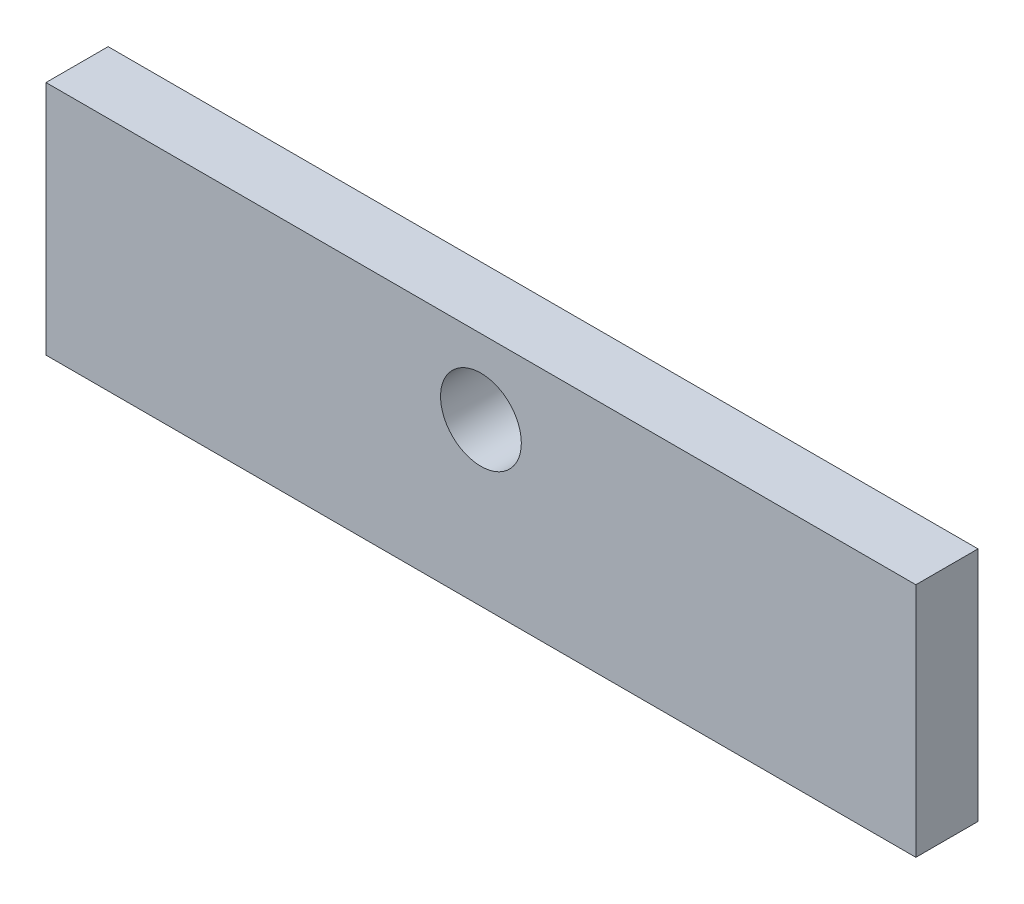
from build123d import *

# Parameters (mm, degrees)
SKETCH1_W           = 700
SKETCH1_H           = 190
BOSS_EXTRUDE1_DEPTH = 50
CUT_EXTRUDE1_REACH  = 394.301
SKETCH2_R           = 32.5


with BuildPart() as part:
    # Sketch1 → Boss-Extrude1 (new body)
    with BuildSketch(Plane.XY):
        with Locations((0, 75)):
            Rectangle(SKETCH1_W, SKETCH1_H)
    extrude(amount=BOSS_EXTRUDE1_DEPTH)

    # Sketch2 → Cut-Extrude1 (cut, up to next)
    with BuildSketch(Plane.XY.offset(50), mode=Mode.PRIVATE) as cut_extrude1_sk1:
        with Locations((0, 110)):
            Circle(SKETCH2_R)
    cut_extrude1_tool1 = extrude(cut_extrude1_sk1.sketch, amount=-CUT_EXTRUDE1_REACH, mode=Mode.PRIVATE) & part.part
    add(cut_extrude1_tool1.solids().sort_by_distance((0, 110, 50))[0], mode=Mode.SUBTRACT)


solid = part.part
